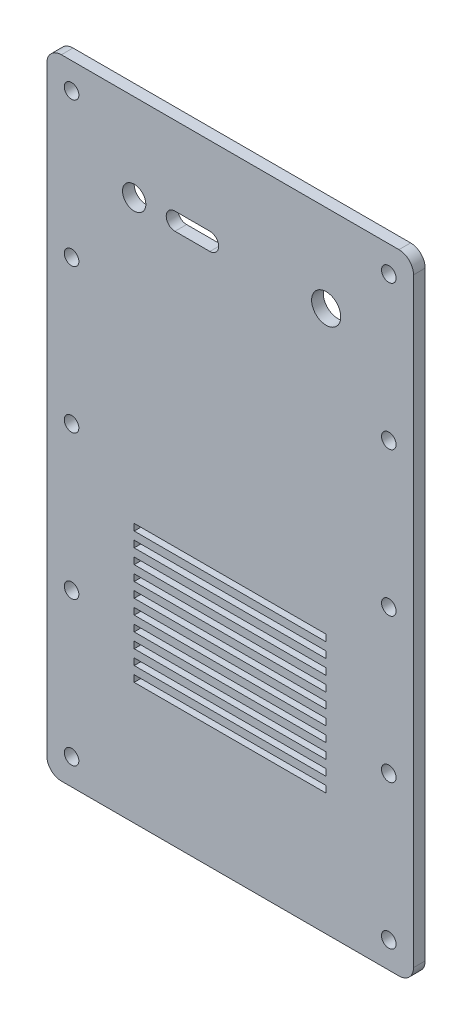
from build123d import *

# Parameters (mm, degrees)
SKETCH1_W           = 62.96
SKETCH1_H           = 108
BOSS_EXTRUDE1_DEPTH = 2
FILLET1_R           = 2.5
SKETCH2_R           = 1.25
CUT_EXTRUDE1_DEPTH  = 2
SKETCH3_R           = 2.5
SKETCH3_R_2         = 2
SKETCH3_W           = 32.96
SKETCH3_H           = 1.138869598
CUT_EXTRUDE2_DEPTH  = 2


with BuildPart() as part:
    # Sketch1 → Boss-Extrude1 (new body)
    with BuildSketch(Plane.XY):
        Rectangle(SKETCH1_W, SKETCH1_H)
    extrude(amount=BOSS_EXTRUDE1_DEPTH)

    # Fillet1
    fillet1_edges = [part.edges().sort_by_distance(p)[0] for p in [
        (31.48, -54, 1),
        (-31.48, -54, 1),
        (-31.48, 54, 1),
        (31.48, 54, 1),
    ]]
    fillet(fillet1_edges, radius=FILLET1_R)

    # Sketch2 → Cut-Extrude1 (cut)
    with BuildSketch(Plane.XY.offset(2)):
        with Locations((-27.23, 49.5)):
            Circle(SKETCH2_R)
        with Locations((27.23, 49.5)):
            Circle(SKETCH2_R)
        with Locations((27.23, 24.75)):
            Circle(SKETCH2_R)
        with Locations((27.23, 0)):
            Circle(SKETCH2_R)
        with Locations((27.23, -24.75)):
            Circle(SKETCH2_R)
        with Locations((27.23, -49.5)):
            Circle(SKETCH2_R)
        with Locations((-27.23, 24.75)):
            Circle(SKETCH2_R)
        with Locations((-27.23, 0)):
            Circle(SKETCH2_R)
        with Locations((-27.23, -24.75)):
            Circle(SKETCH2_R)
        with Locations((-27.23, -49.5)):
            Circle(SKETCH2_R)
    extrude(amount=-CUT_EXTRUDE1_DEPTH, mode=Mode.SUBTRACT)

    # Sketch3 → Cut-Extrude2 (cut)
    with BuildSketch(Plane.XY.offset(2)):
        with Locations((16.48, 39)):
            Circle(SKETCH3_R)
        with Locations((-16.48, 39)):
            Circle(SKETCH3_R_2)
        with BuildLine():
            Line((-9.48, 40.5), (-3.48, 40.5))
            ThreePointArc((-3.48, 40.5), (-1.98, 39), (-3.48, 37.5))
            Line((-3.48, 37.5), (-9.48, 37.5))
            ThreePointArc((-9.48, 37.5), (-10.98, 39), (-9.48, 40.5))
        make_face()
        with Locations((0, -12.5)):
            Rectangle(SKETCH3_W, SKETCH3_H)
        with Locations((0, -10)):
            Rectangle(SKETCH3_W, SKETCH3_H)
        with Locations((0, -15)):
            Rectangle(SKETCH3_W, SKETCH3_H)
        with Locations((0, -17.5)):
            Rectangle(SKETCH3_W, SKETCH3_H)
        with Locations((0, -20)):
            Rectangle(SKETCH3_W, SKETCH3_H)
        with Locations((0, -22.5)):
            Rectangle(SKETCH3_W, SKETCH3_H)
        with Locations((0, -25)):
            Rectangle(SKETCH3_W, SKETCH3_H)
        with Locations((0, -27.5)):
            Rectangle(SKETCH3_W, SKETCH3_H)
        with Locations((0, -30)):
            Rectangle(SKETCH3_W, SKETCH3_H)
        with Locations((0, -32.5)):
            Rectangle(SKETCH3_W, SKETCH3_H)
    extrude(amount=-CUT_EXTRUDE2_DEPTH, mode=Mode.SUBTRACT)


solid = part.part
